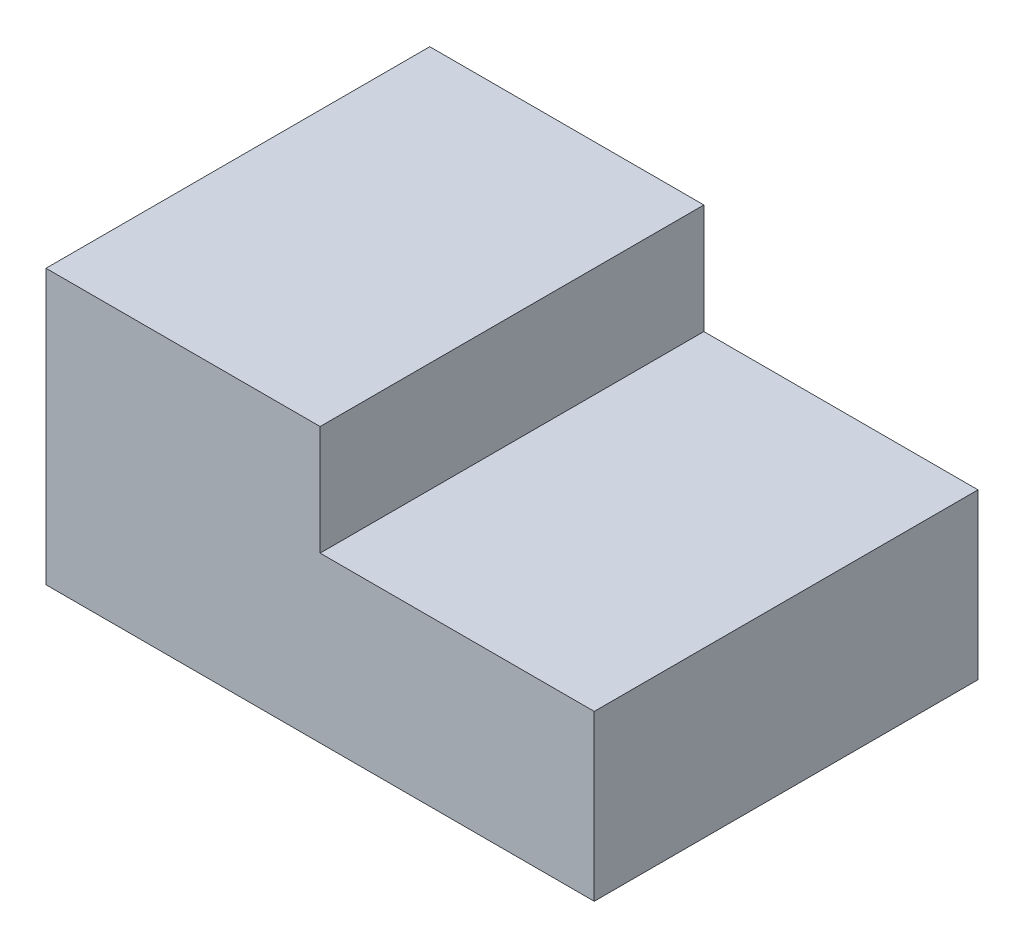
from build123d import *

# Parameters (mm, degrees)
EXTRUDE_1_DEPTH     = 3.5
SKETCH_2_W          = 3.2
SKETCH_2_H          = 3.2
CUT_EXTRUDE_1_DEPTH = 3


with BuildPart() as part:
    # 草图1 → 凸台-拉伸1 (new, symmetric)
    with BuildSketch(Plane.XY):
        Polygon((0, 0), (10, 0), (10, 3), (5, 3), (5, 5), (0, 5), align=None)
    extrude(amount=EXTRUDE_1_DEPTH, both=True)

    # 草图2 → 切除-拉伸1 (cut)
    with BuildSketch(Plane.ZY):
        with Locations((0, 2.5)):
            Rectangle(SKETCH_2_W, SKETCH_2_H)
    extrude(amount=-CUT_EXTRUDE_1_DEPTH, mode=Mode.SUBTRACT)


solid = part.part
